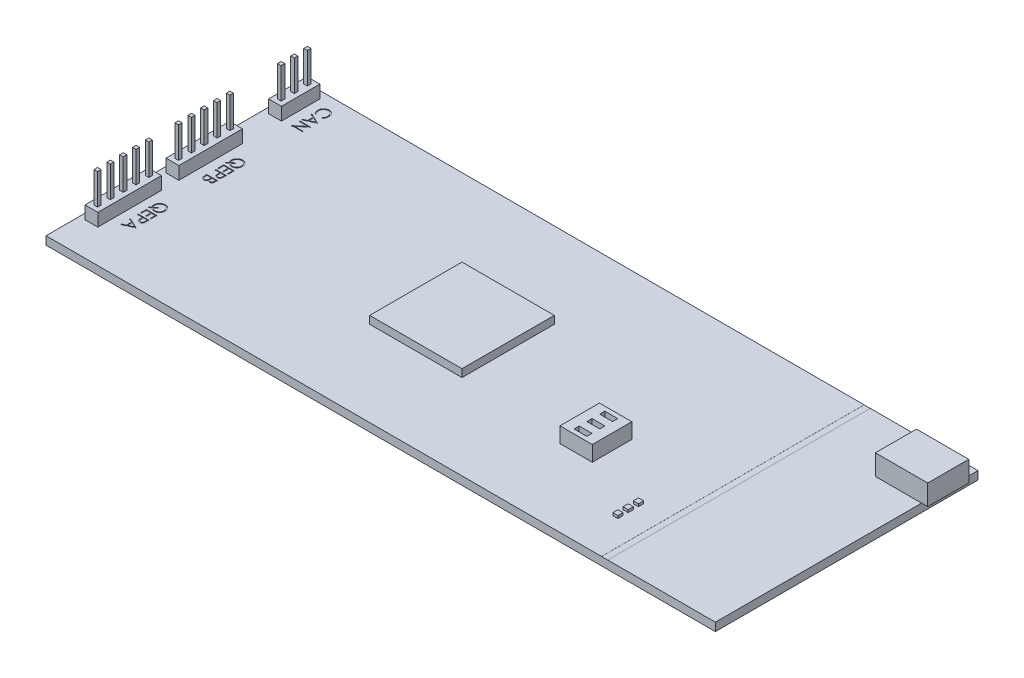
from build123d import *

# Parameters (mm, degrees)
SKIZZE1_W                            = 130.5
SKIZZE1_H                            = 51.2
AUFSATZ_LINEAR_AUSTRAGEN1_DEPTH      = 1.6
AUFSATZ_LINEAR_AUSTRAGEN2_DEPTH      = 1.2
AUFSATZ_LINEAR_AUSTRAGEN2_DEPTH_BACK = 9
SKIZZE2_W                            = 8
SKIZZE2_H                            = 4
SKIZZE4_W                            = 2.5
SKIZZE4_H                            = 7.5
SKIZZE4_H_2                          = 12.4
AUFSATZ_LINEAR_AUSTRAGEN3_DEPTH      = 2.5
SKIZZE5_W                            = 0.7
SKIZZE5_H                            = 0.7
AUFSATZ_LINEAR_AUSTRAGEN4_DEPTH      = 6
SKIZZE6_W                            = 1.2
SKIZZE6_H                            = 51.2
SCHNITT_LINEAR_AUSTRAGEN1_DEPTH      = 0.01
SKIZZE7_W                            = 18
SKIZZE7_H                            = 18
AUFSATZ_LINEAR_AUSTRAGEN5_DEPTH      = 1.5
SKIZZE8_W                            = 6.3
SKIZZE8_H                            = 7.7
AUFSATZ_LINEAR_AUSTRAGEN6_DEPTH      = 3
SKIZZE9_W                            = 2.5
SKIZZE9_H                            = 1
SCHNITT_LINEAR_AUSTRAGEN2_DEPTH      = 1
SKIZZE10_W                           = 1
SKIZZE10_H                           = 1
AUFSATZ_LINEAR_AUSTRAGEN7_DEPTH      = 0.5
SCHNITT_LINEAR_AUSTRAGEN3_DEPTH      = 0.1


with BuildPart() as part:
    # Skizze1 → Aufsatz-Linear austragen1 (new body)
    with BuildSketch(Plane(origin=(0, 0, 0), x_dir=(1, 0, 0), z_dir=(0, 1, 0))):
        Rectangle(SKIZZE1_W, SKIZZE1_H)
    extrude(amount=AUFSATZ_LINEAR_AUSTRAGEN1_DEPTH)

    # Skizze2 → Aufsatz-Linear austragen2 (add, two sides: drawn at the far end of the back side and taken through both)
    with BuildSketch(Plane(origin=(65.25, 0, 0), x_dir=(0, 0, -1), z_dir=(1, 0, 0)).offset(-AUFSATZ_LINEAR_AUSTRAGEN2_DEPTH_BACK)):
        with Locations((18.6, 3.6)):
            Rectangle(SKIZZE2_W, SKIZZE2_H)
    extrude(amount=AUFSATZ_LINEAR_AUSTRAGEN2_DEPTH + AUFSATZ_LINEAR_AUSTRAGEN2_DEPTH_BACK)

    # Skizze4 → Aufsatz-Linear austragen3 (add)
    with BuildSketch(Plane(origin=(0, 1.6, 0), x_dir=(1, 0, 0), z_dir=(0, 1, 0))):
        with Locations((-62.9, 20.45)):
            Rectangle(SKIZZE4_W, SKIZZE4_H)
        with Locations((-62.9, 2.9)):
            Rectangle(SKIZZE4_W, SKIZZE4_H_2)
        with Locations((-62.9, -12.9)):
            Rectangle(SKIZZE4_W, SKIZZE4_H_2)
    extrude(amount=AUFSATZ_LINEAR_AUSTRAGEN3_DEPTH)

    # Skizze5 → Aufsatz-Linear austragen4 (add)
    with BuildSketch(Plane(origin=(0, 4.1, 0), x_dir=(1, 0, 0), z_dir=(0, 1, 0))):
        with Locations((-62.9, 23)):
            Rectangle(SKIZZE5_W, SKIZZE5_H)
        with Locations((-62.9, 20.45)):
            Rectangle(SKIZZE5_W, SKIZZE5_H)
        with Locations((-62.9, 17.9)):
            Rectangle(SKIZZE5_W, SKIZZE5_H)
        with Locations((-62.9, 7.9)):
            Rectangle(SKIZZE5_W, SKIZZE5_H)
        with Locations((-62.9, 5.4)):
            Rectangle(SKIZZE5_W, SKIZZE5_H)
        with Locations((-62.9, 2.9)):
            Rectangle(SKIZZE5_W, SKIZZE5_H)
        with Locations((-62.9, 0.4)):
            Rectangle(SKIZZE5_W, SKIZZE5_H)
        with Locations((-62.9, -2.1)):
            Rectangle(SKIZZE5_W, SKIZZE5_H)
        with Locations((-62.9, -7.9)):
            Rectangle(SKIZZE5_W, SKIZZE5_H)
        with Locations((-62.9, -10.4)):
            Rectangle(SKIZZE5_W, SKIZZE5_H)
        with Locations((-62.9, -12.9)):
            Rectangle(SKIZZE5_W, SKIZZE5_H)
        with Locations((-62.9, -15.4)):
            Rectangle(SKIZZE5_W, SKIZZE5_H)
        with Locations((-62.9, -17.9)):
            Rectangle(SKIZZE5_W, SKIZZE5_H)
    extrude(amount=AUFSATZ_LINEAR_AUSTRAGEN4_DEPTH)

    # Skizze6 → Schnitt-Linear austragen1 (cut)
    with BuildSketch(Plane(origin=(0, 1.6, 0), x_dir=(1, 0, 0), z_dir=(0, 1, 0))):
        with Locations((43.65, 0)):
            Rectangle(SKIZZE6_W, SKIZZE6_H)
    extrude(amount=-SCHNITT_LINEAR_AUSTRAGEN1_DEPTH, mode=Mode.SUBTRACT)

    # Skizze7 → Aufsatz-Linear austragen5 (add)
    with BuildSketch(Plane(origin=(0, 1.6, 0), x_dir=(1, 0, 0), z_dir=(0, 1, 0))):
        with Locations((-9.75, 0)):
            Rectangle(SKIZZE7_W, SKIZZE7_H)
    extrude(amount=AUFSATZ_LINEAR_AUSTRAGEN5_DEPTH)

    # Skizze8 → Aufsatz-Linear austragen6 (add)
    with BuildSketch(Plane(origin=(0, 1.6, 0), x_dir=(1, 0, 0), z_dir=(0, 1, 0))):
        with Locations((23.1, -6.75)):
            Rectangle(SKIZZE8_W, SKIZZE8_H)
    extrude(amount=AUFSATZ_LINEAR_AUSTRAGEN6_DEPTH)

    # Skizze9 → Schnitt-Linear austragen2 (cut)
    with BuildSketch(Plane(origin=(0, 4.6, 0), x_dir=(1, 0, 0), z_dir=(0, 1, 0))):
        with Locations((23.1, -4.25)):
            Rectangle(SKIZZE9_W, SKIZZE9_H)
        with Locations((23.1, -6.75)):
            Rectangle(SKIZZE9_W, SKIZZE9_H)
        with Locations((23.1, -9.25)):
            Rectangle(SKIZZE9_W, SKIZZE9_H)
    extrude(amount=-SCHNITT_LINEAR_AUSTRAGEN2_DEPTH, mode=Mode.SUBTRACT)

    # Skizze10 → Aufsatz-Linear austragen7 (add)
    with BuildSketch(Plane(origin=(0, 1.6, 0), x_dir=(1, 0, 0), z_dir=(0, 1, 0))):
        with Locations((37.75, -13.1)):
            Rectangle(SKIZZE10_W, SKIZZE10_H)
        with Locations((37.75, -15.1)):
            Rectangle(SKIZZE10_W, SKIZZE10_H)
        with Locations((37.75, -17.1)):
            Rectangle(SKIZZE10_W, SKIZZE10_H)
    extrude(amount=AUFSATZ_LINEAR_AUSTRAGEN7_DEPTH)

    # Skizze11 → Schnitt-Linear austragen3 (cut)
    # profile 1 of 11: a face of its own
    with BuildSketch(Plane(origin=(0, 1.6, 0), x_dir=(1, 0, 0), z_dir=(0, 1, 0))):
        with BuildLine():
            Line((-59.654629934, 4.468969889), (-60.049308686, 4.146928822))
            Line((-60.049308686, 4.146928822), (-60.049308686, 4.381636718))
            Line((-60.049308686, 4.381636718), (-59.76463614, 4.614245259))
            add(Edge.make_bspline(
                [(-59.76463614, 4.614245259), (-59.778813299, 4.637574949), (-59.806906463, 4.683804577), (-59.843116991, 4.755886863), (-59.873248874, 4.829402609), (-59.898143303, 4.904189153), (-59.918069834, 4.980137564), (-59.931899689, 5.05763297), (-59.939930513, 5.136394302), (-59.941188906, 5.189310659), (-59.941821707, 5.21592042)],
                knots=[0, 0, 0, 0, 1.030216282, 2.041455142, 3.041201647, 4.026904037, 5.014869161, 6.002481075, 6.995518502, 8, 8, 8, 8], degree=3))
            add(Edge.make_bspline(
                [(-59.941821707, 5.21592042), (-59.940901756, 5.254043165), (-59.939091565, 5.329057377), (-59.923341685, 5.439238054), (-59.898860966, 5.54508193), (-59.863915556, 5.646317067), (-59.818555313, 5.742761657), (-59.763199092, 5.834711943), (-59.697952765, 5.922200169), (-59.623447565, 6.003887969), (-59.542387484, 6.078579763), (-59.455780755, 6.144118012), (-59.365061759, 6.199843008), (-59.269778826, 6.244900043), (-59.170761275, 6.280658808), (-59.067185657, 6.305027439), (-58.95966853, 6.32080097), (-58.886462471, 6.322618119), (-58.849317333, 6.323540151)],
                knots=[0, 0, 0, 0, 1.05574053, 2.077383083, 3.077194498, 4.061905691, 5.03852134, 6.024727803, 7.030589082, 8.057245348, 9.083652609, 10.080210343, 11.061793968, 12.027891381, 12.99559829, 13.972775731, 14.971375788, 16, 16, 16, 16], degree=3))
            add(Edge.make_bspline(
                [(-58.849317333, 6.323540151), (-58.824386188, 6.323212102), (-58.77469906, 6.322558309), (-58.701107336, 6.314995265), (-58.628727123, 6.303758456), (-58.557859204, 6.287864425), (-58.488213097, 6.267057817), (-58.419926153, 6.242112828), (-58.353174254, 6.211888704), (-58.288094308, 6.177720879), (-58.225249293, 6.139614644), (-58.165537613, 6.098102135), (-58.109533244, 6.053092765), (-58.057315163, 6.004575994), (-58.008495941, 5.952824279), (-57.963173869, 5.897849954), (-57.921317466, 5.839533123), (-57.883394498, 5.778176133), (-57.849456271, 5.714303743), (-57.819438964, 5.648979827), (-57.79476201, 5.581762067), (-57.774013037, 5.513266169), (-57.75807213, 5.443101113), (-57.746922716, 5.371405233), (-57.739285374, 5.298240311), (-57.738656141, 5.248830044), (-57.738338634, 5.223897969)],
                knots=[0, 0, 0, 0, 1.030754547, 2.054267169, 3.056358621, 4.059035041, 5.05535882, 6.060771698, 7.063448118, 8.083599711, 9.099159154, 10.101167011, 11.089250986, 12.068187652, 13.04685046, 14.029613114, 15.012716649, 16.013469748, 17.010449097, 18.0025771, 18.984265202, 19.969496577, 20.960881312, 21.957255534, 22.969245453, 24, 24, 24, 24], degree=3))
            add(Edge.make_bspline(
                [(-57.738338634, 5.223897969), (-57.739252448, 5.185774558), (-57.741047236, 5.110897738), (-57.756821339, 5.000997495), (-57.781289755, 4.895566594), (-57.816326656, 4.79464607), (-57.861635412, 4.698342893), (-57.916695665, 4.606445123), (-57.982513267, 4.519668454), (-58.056574427, 4.438040238), (-58.137874106, 4.363486689), (-58.225202164, 4.298748857), (-58.316654867, 4.243184447), (-58.412948495, 4.198075837), (-58.513842965, 4.163003639), (-58.619413765, 4.138494988), (-58.729463263, 4.122793202), (-58.80447693, 4.120979045), (-58.842599397, 4.120057078)],
                knots=[0, 0, 0, 0, 1.050621994, 2.063488829, 3.054696817, 4.03098776, 5.002868493, 5.984293541, 6.979100426, 8.000779165, 9.019604587, 10.015189519, 10.993309009, 11.965189742, 12.941480684, 13.932688673, 14.949378006, 16, 16, 16, 16], degree=3))
            add(Edge.make_bspline(
                [(-58.842599397, 4.120057078), (-58.882269411, 4.121051498), (-58.960278247, 4.123006971), (-59.074578654, 4.140053183), (-59.183984052, 4.166463061), (-59.287954481, 4.205115654), (-59.386977599, 4.254673563), (-59.481345227, 4.315247147), (-59.571905185, 4.386166599), (-59.626764618, 4.441078117), (-59.654629934, 4.468969889)],
                knots=[0, 0, 0, 0, 1.045518584, 2.0559531, 3.040547655, 4.008540931, 4.974054662, 5.954823866, 6.961172636, 8, 8, 8, 8], degree=3))
        make_face()
        with BuildLine():
            add(Edge.make_bspline(
                [(-59.499697531, 4.595351064), (-59.476472114, 4.572481542), (-59.430786688, 4.527496179), (-59.355865008, 4.469128555), (-59.277985439, 4.418926542), (-59.196111999, 4.378734366), (-59.111270441, 4.346756011), (-59.022788514, 4.324662479), (-58.93106903, 4.310828856), (-58.868680595, 4.309055689), (-58.837141073, 4.308159291)],
                knots=[0, 0, 0, 0, 1.052210109, 2.069743939, 3.061837814, 4.040478349, 5.010453814, 5.985306305, 6.981502329, 8, 8, 8, 8], degree=3))
            add(Edge.make_bspline(
                [(-58.837141073, 4.308159291), (-58.816830013, 4.308393506), (-58.776678627, 4.308856509), (-58.717261619, 4.315222782), (-58.659156912, 4.324229166), (-58.602468325, 4.337267648), (-58.547310711, 4.35405801), (-58.493758947, 4.374795581), (-58.44164027, 4.399076324), (-58.39127844, 4.427382365), (-58.34274645, 4.45858738), (-58.296637823, 4.493322389), (-58.253190309, 4.531098479), (-58.211687913, 4.571502962), (-58.172986152, 4.615314836), (-58.137101616, 4.662376976), (-58.103165908, 4.712109469), (-58.072534552, 4.764758413), (-58.0443738, 4.819013134), (-58.019988331, 4.874556167), (-57.999334713, 4.930921134), (-57.982587281, 4.988020751), (-57.969404919, 5.04578113), (-57.960408613, 5.104303538), (-57.954048896, 5.163436636), (-57.953558236, 5.203167421), (-57.953312592, 5.223058227)],
                knots=[0, 0, 0, 0, 1.032958288, 2.041976502, 3.037103433, 4.023477888, 4.998866292, 5.968231228, 6.943073582, 7.921783703, 8.90545537, 9.876780072, 10.85618943, 11.833110341, 12.821898168, 13.827467856, 14.842673888, 15.88323808, 16.924703457, 17.951432745, 18.967462636, 19.976958182, 20.977218729, 21.979378626, 22.98839684, 24, 24, 24, 24], degree=3))
            add(Edge.make_bspline(
                [(-57.953312592, 5.223058227), (-57.953559976, 5.243088609), (-57.954054107, 5.283097923), (-57.960373133, 5.342516674), (-57.96941595, 5.401172758), (-57.982527457, 5.458811984), (-57.999327464, 5.515624275), (-58.019985965, 5.571366278), (-58.043993255, 5.626448952), (-58.071980968, 5.680050976), (-58.103048736, 5.731996969), (-58.136367856, 5.781704744), (-58.173164337, 5.82789742), (-58.212227173, 5.871294579), (-58.254069638, 5.911784078), (-58.298376486, 5.949582093), (-58.345671704, 5.984018171), (-58.395106456, 6.015568451), (-58.446735167, 6.043453993), (-58.499626141, 6.068603238), (-58.554362544, 6.089030005), (-58.610506255, 6.10579995), (-58.6679177, 6.119503532), (-58.726930148, 6.128336023), (-58.787175209, 6.134750051), (-58.827886133, 6.135206876), (-58.848477591, 6.135437937)],
                knots=[0, 0, 0, 0, 1.013232303, 2.023861962, 3.020621903, 4.015492728, 5.012755829, 6.016661994, 7.022041205, 8.051604144, 9.07437186, 10.084107639, 11.077439333, 12.060337995, 13.03706716, 14.02195431, 15.005108131, 15.995405045, 16.987448092, 17.972869919, 18.956865295, 19.940554735, 20.937012659, 21.9407689, 22.958447392, 24, 24, 24, 24], degree=3))
            add(Edge.make_bspline(
                [(-58.848477591, 6.135437937), (-58.878749901, 6.134647252), (-58.9383049, 6.133091731), (-59.025769478, 6.12032083), (-59.109349865, 6.098610924), (-59.189778463, 6.069307749), (-59.266389871, 6.030767444), (-59.339592169, 5.983964702), (-59.408436412, 5.927927951), (-59.473608062, 5.865081881), (-59.532642067, 5.795928165), (-59.584600775, 5.72262429), (-59.628682541, 5.645789169), (-59.66426182, 5.565183345), (-59.692833145, 5.48140742), (-59.712176512, 5.393800197), (-59.724997813, 5.302934334), (-59.726225326, 5.241017766), (-59.726847749, 5.209622355)],
                knots=[0, 0, 0, 0, 1.022497099, 2.011568113, 2.978414599, 3.935907004, 4.898116866, 5.870095606, 6.865600239, 7.892254889, 8.925238965, 9.932855416, 10.924083129, 11.912667955, 12.905586126, 13.909344924, 14.939912558, 16, 16, 16, 16], degree=3))
            add(Edge.make_bspline(
                [(-59.726847749, 5.209622355), (-59.726613953, 5.188052233), (-59.726151523, 5.145388055), (-59.719798222, 5.08247993), (-59.710961924, 5.02122736), (-59.697186398, 4.962016629), (-59.680558993, 4.904281363), (-59.659941505, 4.848437951), (-59.635639108, 4.794341539), (-59.616398933, 4.75994797), (-59.606764639, 4.742725789)],
                knots=[0, 0, 0, 0, 1.060709028, 2.098007545, 3.107816471, 4.10334608, 5.086030226, 6.061961114, 7.029549518, 8, 8, 8, 8], degree=3))
            Line((-59.606764639, 4.742725789), (-59.028182384, 5.214660807))
            Line((-59.028182384, 5.214660807), (-59.028182384, 4.979952911))
            Line((-59.028182384, 4.979952911), (-59.499697531, 4.595351064))
        make_face(mode=Mode.SUBTRACT)
    # profile 2 of 11: a face of its own
    with BuildSketch(Plane(origin=(0, 1.6, 0), x_dir=(1, 0, 0), z_dir=(0, 1, 0))):
        Polygon((-57.792082124, 3.690109161), (-57.792082124, 2.50775239), (-58.007056082, 2.50775239), (-58.007056082, 3.502006947), (-58.651977957, 3.502006947), (-58.651977957, 2.50775239), (-58.866951915, 2.50775239), (-58.866951915, 3.502006947), (-59.673104259, 3.502006947), (-59.673104259, 2.50775239), (-59.888078217, 2.50775239), (-59.888078217, 3.690109161), align=None)
    # profile 3 of 11: a face of its own
    with BuildSketch(Plane(origin=(0, 1.6, 0), x_dir=(1, 0, 0), z_dir=(0, 1, 0))):
        with BuildLine():
            Line((-57.792082124, 2.131547963), (-57.792082124, 1.720494242))
            add(Edge.make_bspline(
                [(-57.792082124, 1.720494242), (-57.792113202, 1.692221706), (-57.79217275, 1.638050272), (-57.793978148, 1.560369629), (-57.796389557, 1.489818562), (-57.799732307, 1.426549194), (-57.803682715, 1.370366859), (-57.809223355, 1.321525778), (-57.815008481, 1.279642053), (-57.82089009, 1.254546124), (-57.82357245, 1.243100901)],
                knots=[0, 0, 0, 0, 1.415646017, 2.712440637, 3.8905458, 4.950247383, 5.884950622, 6.709939814, 7.411656543, 8, 8, 8, 8], degree=3))
            add(Edge.make_bspline(
                [(-57.82357245, 1.243100901), (-57.827538009, 1.228612423), (-57.835375684, 1.199976871), (-57.851074442, 1.158715561), (-57.869686284, 1.119456408), (-57.890907148, 1.082075684), (-57.915605286, 1.046992298), (-57.942999425, 1.01375716), (-57.973074493, 0.982179641), (-58.006413518, 0.953332422), (-58.041787299, 0.926774852), (-58.07998363, 0.903992487), (-58.120171183, 0.884721613), (-58.162761526, 0.868983179), (-58.207495808, 0.857015897), (-58.254504622, 0.848174092), (-58.30362644, 0.842516995), (-58.337198945, 0.841978394), (-58.354289409, 0.841704213)],
                knots=[0, 0, 0, 0, 0.999487232, 1.975422798, 2.933948774, 3.889618007, 4.832992075, 5.786114792, 6.754729845, 7.731954186, 8.717668599, 9.695514499, 10.68728626, 11.680675814, 12.71351902, 13.766008651, 14.862761406, 16, 16, 16, 16], degree=3))
            add(Edge.make_bspline(
                [(-58.354289409, 0.841704213), (-58.371523154, 0.841956586), (-58.40524214, 0.84245037), (-58.454571581, 0.84837682), (-58.501712563, 0.856359686), (-58.546560562, 0.868634469), (-58.588849242, 0.884711162), (-58.629224853, 0.903570368), (-58.667000495, 0.926317034), (-58.702313308, 0.952454003), (-58.73519644, 0.981529418), (-58.765411598, 1.013420261), (-58.792781917, 1.047997784), (-58.817368756, 1.085152099), (-58.838601962, 1.125245419), (-58.857620016, 1.16766967), (-58.873592141, 1.212793601), (-58.881994128, 1.24401946), (-58.886265982, 1.259895741)],
                knots=[0, 0, 0, 0, 1.121902311, 2.195077645, 3.232258892, 4.234102512, 5.217864754, 6.176164875, 7.132989551, 8.084763148, 9.034132444, 9.988522005, 10.94243251, 11.903244335, 12.886203696, 13.894208494, 14.929344452, 16, 16, 16, 16], degree=3))
            add(Edge.make_bspline(
                [(-58.886265982, 1.259895741), (-58.889058436, 1.273027057), (-58.895178262, 1.3018051), (-58.902010285, 1.349200196), (-58.907841706, 1.404382016), (-58.912214036, 1.467275241), (-58.915957107, 1.537823419), (-58.91893228, 1.616064712), (-58.92056707, 1.702152707), (-58.920651384, 1.762200746), (-58.920695405, 1.793551798)],
                knots=[0, 0, 0, 0, 0.601384939, 1.31797006, 2.144135048, 3.087295005, 4.142315834, 5.309527816, 6.595305764, 8, 8, 8, 8], degree=3))
            Line((-58.920695405, 1.793551798), (-58.920695405, 1.94344575))
            Line((-58.920695405, 1.94344575), (-59.888078217, 1.94344575))
            Line((-59.888078217, 1.94344575), (-59.888078217, 2.131547963))
            Line((-59.888078217, 2.131547963), (-57.792082124, 2.131547963))
        make_face()
        with BuildLine():
            Line((-58.007056082, 1.94344575), (-58.705721447, 1.94344575))
            Line((-58.705721447, 1.94344575), (-58.710340028, 1.576478485))
            add(Edge.make_bspline(
                [(-58.710340028, 1.576478485), (-58.710351233, 1.558560582), (-58.710372863, 1.523970439), (-58.707953542, 1.473866952), (-58.705284868, 1.427501723), (-58.70110561, 1.384774063), (-58.695599045, 1.346010499), (-58.689605255, 1.310713127), (-58.681484861, 1.279398682), (-58.670162264, 1.242703886), (-58.651227721, 1.201953472), (-58.623035568, 1.157915677), (-58.588086293, 1.11999016), (-58.548251238, 1.08739033), (-58.503775248, 1.062125549), (-58.45656191, 1.043123212), (-58.406581514, 1.03205446), (-58.372396539, 1.030560865), (-58.355129151, 1.029806427)],
                knots=[0, 0, 0, 0, 1.160368111, 2.240066715, 3.248291599, 4.168343349, 5.019594299, 5.784185847, 6.485545725, 7.113397927, 8.269509094, 9.383373363, 10.487084095, 11.595623793, 12.704274681, 13.786671823, 14.88201193, 16, 16, 16, 16], degree=3))
            add(Edge.make_bspline(
                [(-58.355129151, 1.029806427), (-58.338279542, 1.030564894), (-58.304784605, 1.032072634), (-58.255671811, 1.043210521), (-58.208959388, 1.062088454), (-58.165030953, 1.087561528), (-58.125358924, 1.119225313), (-58.091198399, 1.156310365), (-58.063363571, 1.198059433), (-58.04552174, 1.23691512), (-58.034609899, 1.271406875), (-58.026978426, 1.301369558), (-58.020884433, 1.335199104), (-58.01595024, 1.372907811), (-58.011726207, 1.414203004), (-58.008860104, 1.459439586), (-58.007182432, 1.508446154), (-58.007099218, 1.542467507), (-58.007056082, 1.560103515)],
                knots=[0, 0, 0, 0, 1.120550889, 2.227516482, 3.330715807, 4.461473166, 5.594337325, 6.694900473, 7.802844763, 8.919519911, 9.52614448, 10.208195984, 10.975273469, 11.811520316, 12.738076669, 13.736566072, 14.826679847, 16, 16, 16, 16], degree=3))
            Line((-58.007056082, 1.560103515), (-58.007056082, 1.94344575))
        make_face(mode=Mode.SUBTRACT)
    # profile 4 of 11: a face of its own
    with BuildSketch(Plane(origin=(0, 1.6, 0), x_dir=(1, 0, 0), z_dir=(0, 1, 0))):
        with BuildLine():
            Line((-57.792082124, 0.411756296), (-57.792082124, 0.00280193))
            add(Edge.make_bspline(
                [(-57.792082124, 0.00280193), (-57.792187373, -0.017216915), (-57.792391372, -0.05601842), (-57.795555207, -0.112442301), (-57.799869168, -0.165290633), (-57.806714148, -0.214578743), (-57.814973437, -0.260283856), (-57.82497542, -0.302543711), (-57.836968478, -0.341223925), (-57.856039816, -0.387403351), (-57.88437958, -0.440055169), (-57.926256723, -0.4970653), (-57.977478354, -0.54581472), (-58.035257574, -0.587846219), (-58.09881762, -0.621263056), (-58.166643568, -0.645438453), (-58.23786057, -0.66074394), (-58.286753079, -0.662317994), (-58.311462566, -0.663113495)],
                knots=[0, 0, 0, 0, 1.001505555, 1.941167018, 2.826882275, 3.653841531, 4.429895133, 5.150066043, 5.825578002, 6.45369114, 7.647487171, 8.808567382, 9.977351308, 11.170798116, 12.373658725, 13.556498008, 14.765093433, 16, 16, 16, 16], degree=3))
            add(Edge.make_bspline(
                [(-58.311462566, -0.663113495), (-58.334613804, -0.662471468), (-58.38010817, -0.661209823), (-58.446541526, -0.648734663), (-58.510040956, -0.630160928), (-58.569823643, -0.603197354), (-58.625121251, -0.568513853), (-58.675605147, -0.526776263), (-58.720051898, -0.477082205), (-58.744796463, -0.439790445), (-58.757365581, -0.420847921)],
                knots=[0, 0, 0, 0, 1.044266239, 2.052081639, 3.041743201, 4.026043445, 5.00270663, 5.980942822, 6.97441044, 8, 8, 8, 8], degree=3))
            add(Edge.make_bspline(
                [(-58.757365581, -0.420847921), (-58.766500063, -0.444662681), (-58.78397659, -0.490226215), (-58.815043007, -0.552972741), (-58.848451549, -0.607249879), (-58.885128453, -0.653117372), (-58.925156633, -0.691753636), (-58.967734547, -0.726449803), (-59.014958365, -0.755517412), (-59.065483423, -0.780488939), (-59.118955109, -0.800141268), (-59.175128879, -0.814046581), (-59.233376606, -0.822590719), (-59.273078351, -0.823755797), (-59.293120993, -0.824343964)],
                knots=[0, 0, 0, 0, 1.272302504, 2.434229863, 3.488457646, 4.447234501, 5.35599188, 6.26022912, 7.18267843, 8.11661068, 9.06895546, 10.019249207, 11.000057067, 12, 12, 12, 12], degree=3))
            add(Edge.make_bspline(
                [(-59.293120993, -0.824343964), (-59.313581914, -0.82375879), (-59.35383935, -0.822607445), (-59.412981115, -0.814118305), (-59.46949203, -0.79973067), (-59.523773897, -0.779961272), (-59.575519461, -0.75401312), (-59.625376792, -0.723115633), (-59.672017724, -0.685509475), (-59.71655143, -0.643592089), (-59.75656901, -0.59611614), (-59.792195767, -0.544900739), (-59.821629534, -0.489209239), (-59.846045563, -0.42990527), (-59.864967861, -0.366594754), (-59.878104598, -0.299512431), (-59.886976757, -0.228643723), (-59.887704834, -0.180010424), (-59.888078217, -0.15506957)],
                knots=[0, 0, 0, 0, 0.978404568, 1.925038397, 2.85041836, 3.763147166, 4.682162379, 5.614488577, 6.562659439, 7.54271123, 8.535210642, 9.526693784, 10.520907202, 11.541451354, 12.589717429, 13.675358278, 14.807842563, 16, 16, 16, 16], degree=3))
            Line((-59.888078217, -0.15506957), (-59.888078217, 0.411756296))
            Line((-59.888078217, 0.411756296), (-57.792082124, 0.411756296))
        make_face()
        with BuildLine():
            Line((-58.007056082, 0.223654083), (-58.678849702, 0.223654083))
            Line((-58.678849702, 0.223654083), (-58.678849702, 0.097272908))
            add(Edge.make_bspline(
                [(-58.678849702, 0.097272908), (-58.678612198, 0.078798755), (-58.678153294, 0.043102926), (-58.676797317, -0.008727639), (-58.67316679, -0.056718355), (-58.669326908, -0.101034591), (-58.663414276, -0.141379318), (-58.656178876, -0.177887602), (-58.648593675, -0.210887399), (-58.635657664, -0.248926116), (-58.616733436, -0.292061517), (-58.58667399, -0.337753222), (-58.551843573, -0.378688184), (-58.510912623, -0.412868361), (-58.466225094, -0.441072982), (-58.417777001, -0.459895522), (-58.367459742, -0.473246102), (-58.33282582, -0.474416861), (-58.315241405, -0.475011282)],
                knots=[0, 0, 0, 0, 1.156481963, 2.23455883, 3.244418989, 4.168404366, 5.01828131, 5.794834307, 6.498111525, 7.13526334, 8.307595709, 9.435046769, 10.546766856, 11.659452936, 12.760769924, 13.837671619, 14.902137667, 16, 16, 16, 16], degree=3))
            add(Edge.make_bspline(
                [(-58.315241405, -0.475011282), (-58.303602686, -0.474713987), (-58.280772067, -0.474130811), (-58.247618479, -0.468823216), (-58.216038518, -0.461121843), (-58.186758499, -0.44908995), (-58.158946202, -0.434540904), (-58.133836957, -0.415615236), (-58.110055129, -0.39424174), (-58.088473928, -0.369140648), (-58.069137087, -0.340433503), (-58.052122364, -0.307846778), (-58.038700664, -0.270991371), (-58.026660684, -0.230702936), (-58.01830625, -0.186336692), (-58.011320831, -0.138326159), (-58.007769949, -0.086264049), (-58.007299345, -0.050245897), (-58.007056082, -0.031627493)],
                knots=[0, 0, 0, 0, 0.911752476, 1.788502045, 2.626783689, 3.45400582, 4.26402138, 5.080402872, 5.911472738, 6.767166405, 7.66795952, 8.620018292, 9.640966946, 10.73819047, 11.913090943, 13.176185384, 14.540321519, 16, 16, 16, 16], degree=3))
            Line((-58.007056082, -0.031627493), (-58.007056082, 0.223654083))
        make_face(mode=Mode.SUBTRACT)
        with BuildLine():
            Line((-58.89382366, 0.223654083), (-59.673104259, 0.223654083))
            Line((-59.673104259, 0.223654083), (-59.673104259, -0.044223623))
            add(Edge.make_bspline(
                [(-59.673104259, -0.044223623), (-59.672875252, -0.063398445), (-59.672433872, -0.100355386), (-59.670977218, -0.153712929), (-59.667733467, -0.203033734), (-59.662445287, -0.248346182), (-59.656950407, -0.290049145), (-59.649345228, -0.327728304), (-59.640699059, -0.361441424), (-59.627318703, -0.400527673), (-59.606567565, -0.444569561), (-59.57507549, -0.49199824), (-59.538051564, -0.534587247), (-59.494660886, -0.570338585), (-59.447838141, -0.599860638), (-59.397828229, -0.620566177), (-59.346156801, -0.633879541), (-59.310835184, -0.635452762), (-59.293120993, -0.63624175)],
                knots=[0, 0, 0, 0, 1.159821618, 2.235403267, 3.228114831, 4.14795534, 4.994323282, 5.771256229, 6.471395042, 7.097801288, 8.267864287, 9.404187171, 10.531774336, 11.667624178, 12.792825787, 13.866573821, 14.930062559, 16, 16, 16, 16], degree=3))
            add(Edge.make_bspline(
                [(-59.293120993, -0.63624175), (-59.282044712, -0.636080484), (-59.260070811, -0.635760551), (-59.227803886, -0.63075415), (-59.196408506, -0.623769894), (-59.166359412, -0.613656091), (-59.137167643, -0.600903405), (-59.109341674, -0.584899267), (-59.082216175, -0.56641752), (-59.047962816, -0.537505961), (-59.008483696, -0.495493282), (-58.969836469, -0.435779856), (-58.938666918, -0.367887139), (-58.925432571, -0.318644571), (-58.91859605, -0.293207133)],
                knots=[0, 0, 0, 0, 0.723503378, 1.435336582, 2.130201219, 2.824764462, 3.504949994, 4.209866579, 4.920640069, 5.648298893, 7.13757748, 8.670694625, 10.280166878, 12, 12, 12, 12], degree=3))
            add(Edge.make_bspline(
                [(-58.91859605, -0.293207133), (-58.916526813, -0.283009166), (-58.91204028, -0.26089787), (-58.907307379, -0.224842014), (-58.903061812, -0.183541098), (-58.900003818, -0.137171648), (-58.896721115, -0.085549248), (-58.895489901, -0.028690482), (-58.89398714, 0.033444848), (-58.893879547, 0.076557967), (-58.89382366, 0.098952392)],
                knots=[0, 0, 0, 0, 0.634452549, 1.375623993, 2.216454381, 3.166361212, 4.209414599, 5.370755378, 6.634280627, 8, 8, 8, 8], degree=3))
            Line((-58.89382366, 0.098952392), (-58.89382366, 0.223654083))
        make_face(mode=Mode.SUBTRACT)
    # profile 5 of 11: a face of its own
    with BuildSketch(Plane(origin=(0, 1.6, 0), x_dir=(1, 0, 0), z_dir=(0, 1, 0))):
        with BuildLine():
            Line((-59.654629934, -10.608142342), (-60.049308686, -10.930183408))
            Line((-60.049308686, -10.930183408), (-60.049308686, -10.695475512))
            Line((-60.049308686, -10.695475512), (-59.76463614, -10.462866971))
            add(Edge.make_bspline(
                [(-59.76463614, -10.462866971), (-59.778813299, -10.439537282), (-59.806906463, -10.393307654), (-59.843116991, -10.321225367), (-59.873248874, -10.247709622), (-59.898143303, -10.172923078), (-59.918069834, -10.096974666), (-59.931899689, -10.01947926), (-59.939930513, -9.940717929), (-59.941188906, -9.887801572), (-59.941821707, -9.861191811)],
                knots=[0, 0, 0, 0, 1.030216282, 2.041455142, 3.041201647, 4.026904037, 5.014869161, 6.002481075, 6.995518502, 8, 8, 8, 8], degree=3))
            add(Edge.make_bspline(
                [(-59.941821707, -9.861191811), (-59.940901756, -9.823069066), (-59.939091565, -9.748054853), (-59.923341685, -9.637874177), (-59.898860966, -9.532030301), (-59.863915556, -9.430795164), (-59.818555313, -9.334350573), (-59.763199092, -9.242400287), (-59.697952765, -9.154912061), (-59.623447565, -9.073224261), (-59.542387484, -8.998532467), (-59.455780755, -8.932994218), (-59.365061759, -8.877269222), (-59.269778826, -8.832212187), (-59.170761275, -8.796453423), (-59.067185657, -8.772084791), (-58.95966853, -8.756311261), (-58.886462471, -8.754494111), (-58.849317333, -8.75357208)],
                knots=[0, 0, 0, 0, 1.05574053, 2.077383083, 3.077194498, 4.061905691, 5.03852134, 6.024727803, 7.030589082, 8.057245348, 9.083652609, 10.080210343, 11.061793968, 12.027891381, 12.99559829, 13.972775731, 14.971375788, 16, 16, 16, 16], degree=3))
            add(Edge.make_bspline(
                [(-58.849317333, -8.75357208), (-58.824386188, -8.753900129), (-58.77469906, -8.754553922), (-58.701107336, -8.762116965), (-58.628727123, -8.773353774), (-58.557859204, -8.789247805), (-58.488213097, -8.810054414), (-58.419926153, -8.834999402), (-58.353174254, -8.865223526), (-58.288094308, -8.899391351), (-58.225249293, -8.937497586), (-58.165537613, -8.979010095), (-58.109533244, -9.024019465), (-58.057315163, -9.072536237), (-58.008495941, -9.124287952), (-57.963173869, -9.179262277), (-57.921317466, -9.237579108), (-57.883394498, -9.298936098), (-57.849456271, -9.362808487), (-57.819438964, -9.428132404), (-57.79476201, -9.495350164), (-57.774013037, -9.563846062), (-57.75807213, -9.634011117), (-57.746922716, -9.705706998), (-57.739285374, -9.77887192), (-57.738656141, -9.828282187), (-57.738338634, -9.853214261)],
                knots=[0, 0, 0, 0, 1.030754547, 2.054267169, 3.056358621, 4.059035041, 5.05535882, 6.060771698, 7.063448118, 8.083599711, 9.099159154, 10.101167011, 11.089250986, 12.068187652, 13.04685046, 14.029613114, 15.012716649, 16.013469748, 17.010449097, 18.0025771, 18.984265202, 19.969496577, 20.960881312, 21.957255534, 22.969245453, 24, 24, 24, 24], degree=3))
            add(Edge.make_bspline(
                [(-57.738338634, -9.853214261), (-57.739252448, -9.891337673), (-57.741047236, -9.966214493), (-57.756821339, -10.076114735), (-57.781289755, -10.181545636), (-57.816326656, -10.28246616), (-57.861635412, -10.378769338), (-57.916695665, -10.470667108), (-57.982513267, -10.557443777), (-58.056574427, -10.639071993), (-58.137874106, -10.713625542), (-58.225202164, -10.778363374), (-58.316654867, -10.833927784), (-58.412948495, -10.879036394), (-58.513842965, -10.914108591), (-58.619413765, -10.938617242), (-58.729463263, -10.954319028), (-58.80447693, -10.956133186), (-58.842599397, -10.957055153)],
                knots=[0, 0, 0, 0, 1.050621994, 2.063488829, 3.054696817, 4.03098776, 5.002868493, 5.984293541, 6.979100426, 8.000779165, 9.019604587, 10.015189519, 10.993309009, 11.965189742, 12.941480684, 13.932688673, 14.949378006, 16, 16, 16, 16], degree=3))
            add(Edge.make_bspline(
                [(-58.842599397, -10.957055153), (-58.882269411, -10.956060732), (-58.960278247, -10.95410526), (-59.074578654, -10.937059048), (-59.183984052, -10.91064917), (-59.287954481, -10.871996577), (-59.386977599, -10.822438667), (-59.481345227, -10.761865084), (-59.571905185, -10.690945631), (-59.626764618, -10.636034114), (-59.654629934, -10.608142342)],
                knots=[0, 0, 0, 0, 1.045518584, 2.0559531, 3.040547655, 4.008540931, 4.974054662, 5.954823866, 6.961172636, 8, 8, 8, 8], degree=3))
        make_face()
        with BuildLine():
            add(Edge.make_bspline(
                [(-59.499697531, -10.481761167), (-59.476472114, -10.504630689), (-59.430786688, -10.549616052), (-59.355865008, -10.607983676), (-59.277985439, -10.658185688), (-59.196111999, -10.698377864), (-59.111270441, -10.73035622), (-59.022788514, -10.752449752), (-58.93106903, -10.766283374), (-58.868680595, -10.768056542), (-58.837141073, -10.768952939)],
                knots=[0, 0, 0, 0, 1.052210109, 2.069743939, 3.061837814, 4.040478349, 5.010453814, 5.985306305, 6.981502329, 8, 8, 8, 8], degree=3))
            add(Edge.make_bspline(
                [(-58.837141073, -10.768952939), (-58.816830013, -10.768718724), (-58.776678627, -10.768255722), (-58.717261619, -10.761889448), (-58.659156912, -10.752883065), (-58.602468325, -10.739844583), (-58.547310711, -10.723054221), (-58.493758947, -10.702316649), (-58.44164027, -10.678035906), (-58.39127844, -10.649729866), (-58.34274645, -10.618524851), (-58.296637823, -10.583789841), (-58.253190309, -10.546013752), (-58.211687913, -10.505609269), (-58.172986152, -10.461797394), (-58.137101616, -10.414735254), (-58.103165908, -10.365002761), (-58.072534552, -10.312353817), (-58.0443738, -10.258099096), (-58.019988331, -10.202556064), (-57.999334713, -10.146191097), (-57.982587281, -10.08909148), (-57.969404919, -10.0313311), (-57.960408613, -9.972808692), (-57.954048896, -9.913675595), (-57.953558236, -9.87394481), (-57.953312592, -9.854054003)],
                knots=[0, 0, 0, 0, 1.032958288, 2.041976502, 3.037103433, 4.023477888, 4.998866292, 5.968231228, 6.943073582, 7.921783703, 8.90545537, 9.876780072, 10.85618943, 11.833110341, 12.821898168, 13.827467856, 14.842673888, 15.88323808, 16.924703457, 17.951432745, 18.967462636, 19.976958182, 20.977218729, 21.979378626, 22.98839684, 24, 24, 24, 24], degree=3))
            add(Edge.make_bspline(
                [(-57.953312592, -9.854054003), (-57.953559976, -9.834023621), (-57.954054107, -9.794014308), (-57.960373133, -9.734595556), (-57.96941595, -9.675939473), (-57.982527457, -9.618300246), (-57.999327464, -9.561487956), (-58.019985965, -9.505745952), (-58.043993255, -9.450663279), (-58.071980968, -9.397061255), (-58.103048736, -9.345115261), (-58.136367856, -9.295407486), (-58.173164337, -9.249214811), (-58.212227173, -9.205817651), (-58.254069638, -9.165328153), (-58.298376486, -9.127530137), (-58.345671704, -9.09309406), (-58.395106456, -9.061543779), (-58.446735167, -9.033658238), (-58.499626141, -9.008508993), (-58.554362544, -8.988082225), (-58.610506255, -8.971312281), (-58.6679177, -8.957608698), (-58.726930148, -8.948776207), (-58.787175209, -8.94236218), (-58.827886133, -8.941905354), (-58.848477591, -8.941674294)],
                knots=[0, 0, 0, 0, 1.013232303, 2.023861962, 3.020621903, 4.015492728, 5.012755829, 6.016661994, 7.022041205, 8.051604144, 9.07437186, 10.084107639, 11.077439333, 12.060337995, 13.03706716, 14.02195431, 15.005108131, 15.995405045, 16.987448092, 17.972869919, 18.956865295, 19.940554735, 20.937012659, 21.9407689, 22.958447392, 24, 24, 24, 24], degree=3))
            add(Edge.make_bspline(
                [(-58.848477591, -8.941674294), (-58.878749901, -8.942464978), (-58.9383049, -8.9440205), (-59.025769478, -8.9567914), (-59.109349865, -8.978501307), (-59.189778463, -9.007804481), (-59.266389871, -9.046344786), (-59.339592169, -9.093147528), (-59.408436412, -9.14918428), (-59.473608062, -9.21203035), (-59.532642067, -9.281184066), (-59.584600775, -9.354487941), (-59.628682541, -9.431323062), (-59.66426182, -9.511928886), (-59.692833145, -9.595704811), (-59.712176512, -9.683312033), (-59.724997813, -9.774177896), (-59.726225326, -9.836094464), (-59.726847749, -9.867489876)],
                knots=[0, 0, 0, 0, 1.022497099, 2.011568113, 2.978414599, 3.935907004, 4.898116866, 5.870095606, 6.865600239, 7.892254889, 8.925238965, 9.932855416, 10.924083129, 11.912667955, 12.905586126, 13.909344924, 14.939912558, 16, 16, 16, 16], degree=3))
            add(Edge.make_bspline(
                [(-59.726847749, -9.867489876), (-59.726613953, -9.889059998), (-59.726151523, -9.931724175), (-59.719798222, -9.9946323), (-59.710961924, -10.05588487), (-59.697186398, -10.115095602), (-59.680558993, -10.172830867), (-59.659941505, -10.22867428), (-59.635639108, -10.282770691), (-59.616398933, -10.317164261), (-59.606764639, -10.334386442)],
                knots=[0, 0, 0, 0, 1.060709028, 2.098007545, 3.107816471, 4.10334608, 5.086030226, 6.061961114, 7.029549518, 8, 8, 8, 8], degree=3))
            Line((-59.606764639, -10.334386442), (-59.028182384, -9.862451424))
            Line((-59.028182384, -9.862451424), (-59.028182384, -10.09715932))
            Line((-59.028182384, -10.09715932), (-59.499697531, -10.481761167))
        make_face(mode=Mode.SUBTRACT)
    # profile 6 of 11: a face of its own
    with BuildSketch(Plane(origin=(0, 1.6, 0), x_dir=(1, 0, 0), z_dir=(0, 1, 0))):
        Polygon((-57.792082124, -11.38700307), (-57.792082124, -12.56935984), (-58.007056082, -12.56935984), (-58.007056082, -11.575105283), (-58.651977957, -11.575105283), (-58.651977957, -12.56935984), (-58.866951915, -12.56935984), (-58.866951915, -11.575105283), (-59.673104259, -11.575105283), (-59.673104259, -12.56935984), (-59.888078217, -12.56935984), (-59.888078217, -11.38700307), align=None)
    # profile 7 of 11: a face of its own
    with BuildSketch(Plane(origin=(0, 1.6, 0), x_dir=(1, 0, 0), z_dir=(0, 1, 0))):
        with BuildLine():
            Line((-57.792082124, -12.945564267), (-57.792082124, -13.356617989))
            add(Edge.make_bspline(
                [(-57.792082124, -13.356617989), (-57.792113202, -13.384890524), (-57.79217275, -13.439061958), (-57.793978148, -13.516742601), (-57.796389557, -13.587293669), (-57.799732307, -13.650563036), (-57.803682715, -13.706745372), (-57.809223355, -13.755586452), (-57.815008481, -13.797470177), (-57.82089009, -13.822566107), (-57.82357245, -13.83401133)],
                knots=[0, 0, 0, 0, 1.415646017, 2.712440637, 3.8905458, 4.950247383, 5.884950622, 6.709939814, 7.411656543, 8, 8, 8, 8], degree=3))
            add(Edge.make_bspline(
                [(-57.82357245, -13.83401133), (-57.827538009, -13.848499807), (-57.835375684, -13.87713536), (-57.851074442, -13.91839667), (-57.869686284, -13.957655822), (-57.890907148, -13.995036546), (-57.915605286, -14.030119932), (-57.942999425, -14.063355071), (-57.973074493, -14.094932589), (-58.006413518, -14.123779809), (-58.041787299, -14.150337378), (-58.07998363, -14.173119744), (-58.120171183, -14.192390618), (-58.162761526, -14.208129052), (-58.207495808, -14.220096333), (-58.254504622, -14.228938138), (-58.30362644, -14.234595235), (-58.337198945, -14.235133836), (-58.354289409, -14.235408017)],
                knots=[0, 0, 0, 0, 0.999487232, 1.975422798, 2.933948774, 3.889618007, 4.832992075, 5.786114792, 6.754729845, 7.731954186, 8.717668599, 9.695514499, 10.68728626, 11.680675814, 12.71351902, 13.766008651, 14.862761406, 16, 16, 16, 16], degree=3))
            add(Edge.make_bspline(
                [(-58.354289409, -14.235408017), (-58.371523154, -14.235155645), (-58.40524214, -14.23466186), (-58.454571581, -14.22873541), (-58.501712563, -14.220752545), (-58.546560562, -14.208477761), (-58.588849242, -14.192401068), (-58.629224853, -14.173541863), (-58.667000495, -14.150795197), (-58.702313308, -14.124658227), (-58.73519644, -14.095582812), (-58.765411598, -14.063691969), (-58.792781917, -14.029114446), (-58.817368756, -13.991960132), (-58.838601962, -13.951866811), (-58.857620016, -13.909442561), (-58.873592141, -13.86431863), (-58.881994128, -13.833092771), (-58.886265982, -13.817216489)],
                knots=[0, 0, 0, 0, 1.121902311, 2.195077645, 3.232258892, 4.234102512, 5.217864754, 6.176164875, 7.132989551, 8.084763148, 9.034132444, 9.988522005, 10.94243251, 11.903244335, 12.886203696, 13.894208494, 14.929344452, 16, 16, 16, 16], degree=3))
            add(Edge.make_bspline(
                [(-58.886265982, -13.817216489), (-58.889058436, -13.804085173), (-58.895178262, -13.77530713), (-58.902010285, -13.727912034), (-58.907841706, -13.672730214), (-58.912214036, -13.609836989), (-58.915957107, -13.539288812), (-58.91893228, -13.461047519), (-58.92056707, -13.374959524), (-58.920651384, -13.314911485), (-58.920695405, -13.283560432)],
                knots=[0, 0, 0, 0, 0.601384939, 1.31797006, 2.144135048, 3.087295005, 4.142315834, 5.309527816, 6.595305764, 8, 8, 8, 8], degree=3))
            Line((-58.920695405, -13.283560432), (-58.920695405, -13.133666481))
            Line((-58.920695405, -13.133666481), (-59.888078217, -13.133666481))
            Line((-59.888078217, -13.133666481), (-59.888078217, -12.945564267))
            Line((-59.888078217, -12.945564267), (-57.792082124, -12.945564267))
        make_face()
        with BuildLine():
            Line((-58.007056082, -13.133666481), (-58.705721447, -13.133666481))
            Line((-58.705721447, -13.133666481), (-58.710340028, -13.500633746))
            add(Edge.make_bspline(
                [(-58.710340028, -13.500633746), (-58.710351233, -13.518551649), (-58.710372863, -13.553141792), (-58.707953542, -13.603245278), (-58.705284868, -13.649610508), (-58.70110561, -13.692338167), (-58.695599045, -13.731101731), (-58.689605255, -13.766399103), (-58.681484861, -13.797713549), (-58.670162264, -13.834408345), (-58.651227721, -13.875158759), (-58.623035568, -13.919196553), (-58.588086293, -13.957122071), (-58.548251238, -13.9897219), (-58.503775248, -14.014986682), (-58.45656191, -14.033989019), (-58.406581514, -14.045057771), (-58.372396539, -14.046551365), (-58.355129151, -14.047305804)],
                knots=[0, 0, 0, 0, 1.160368111, 2.240066715, 3.248291599, 4.168343349, 5.019594299, 5.784185847, 6.485545725, 7.113397927, 8.269509094, 9.383373363, 10.487084095, 11.595623793, 12.704274681, 13.786671823, 14.88201193, 16, 16, 16, 16], degree=3))
            add(Edge.make_bspline(
                [(-58.355129151, -14.047305804), (-58.338279542, -14.046547336), (-58.304784605, -14.045039597), (-58.255671811, -14.033901709), (-58.208959388, -14.015023776), (-58.165030953, -13.989550702), (-58.125358924, -13.957886918), (-58.091198399, -13.920801865), (-58.063363571, -13.879052797), (-58.04552174, -13.84019711), (-58.034609899, -13.805705356), (-58.026978426, -13.775742673), (-58.020884433, -13.741913127), (-58.01595024, -13.70420442), (-58.011726207, -13.662909227), (-58.008860104, -13.617672645), (-58.007182432, -13.568666076), (-58.007099218, -13.534644723), (-58.007056082, -13.517008715)],
                knots=[0, 0, 0, 0, 1.120550889, 2.227516482, 3.330715807, 4.461473166, 5.594337325, 6.694900473, 7.802844763, 8.919519911, 9.52614448, 10.208195984, 10.975273469, 11.811520316, 12.738076669, 13.736566072, 14.826679847, 16, 16, 16, 16], degree=3))
            Line((-58.007056082, -13.517008715), (-58.007056082, -13.133666481))
        make_face(mode=Mode.SUBTRACT)
    # profile 8 of 11: a face of its own
    with BuildSketch(Plane(origin=(0, 1.6, 0), x_dir=(1, 0, 0), z_dir=(0, 1, 0))):
        Polygon((-57.792082124, -15.525251767), (-59.888078217, -16.49263458), (-59.888078217, -16.288157397), (-59.216284598, -15.97829259), (-59.216284598, -15.028124489), (-59.888078217, -14.70944239), (-59.888078217, -14.504125465), (-57.792082124, -15.498380023), align=None)
        Polygon((-58.200616619, -15.50971654), (-59.001310639, -15.130153145), (-59.001310639, -15.879203031), align=None, mode=Mode.SUBTRACT)
    # profile 9 of 11: a face of its own
    with BuildSketch(Plane(origin=(0, 1.6, 0), x_dir=(1, 0, 0), z_dir=(0, 1, 0))):
        with BuildLine():
            Line((-58.159806316, 21.134727702), (-58.287009841, 21.300940308))
            add(Edge.make_bspline(
                [(-58.287009841, 21.300940308), (-58.272878993, 21.312797203), (-58.244807811, 21.336351135), (-58.205389705, 21.374245034), (-58.168459761, 21.41373698), (-58.133842053, 21.454811877), (-58.102747152, 21.498209058), (-58.073554628, 21.542877256), (-58.047387948, 21.589563693), (-58.015660333, 21.654123075), (-57.982551944, 21.738576774), (-57.954791418, 21.844890795), (-57.937119564, 21.955871317), (-57.935205589, 22.031586056), (-57.934232064, 22.070097627)],
                knots=[0, 0, 0, 0, 0.757959112, 1.505699292, 2.245454638, 2.979532153, 3.711538275, 4.438200793, 5.171680507, 5.909471876, 7.393775596, 8.890124382, 10.418191784, 12, 12, 12, 12], degree=3))
            add(Edge.make_bspline(
                [(-57.934232064, 22.070097627), (-57.934477467, 22.091314412), (-57.934965996, 22.13355107), (-57.941365723, 22.196237524), (-57.950464206, 22.257872156), (-57.96363615, 22.318225768), (-57.980784826, 22.377178526), (-58.000895645, 22.435179305), (-58.025921519, 22.491545011), (-58.053559255, 22.546953991), (-58.084784818, 22.600037063), (-58.118833073, 22.650273411), (-58.155369841, 22.69743353), (-58.194300811, 22.7416481), (-58.236109815, 22.782432214), (-58.280305021, 22.820439497), (-58.327418372, 22.85498497), (-58.376566298, 22.886917527), (-58.427821036, 22.915331791), (-58.480860151, 22.939868884), (-58.535480855, 22.960899213), (-58.591795043, 22.977694268), (-58.649581105, 22.990941577), (-58.708961675, 23.00009342), (-58.769821493, 23.006435575), (-58.811071832, 23.006919611), (-58.831864943, 23.007163599)],
                knots=[0, 0, 0, 0, 1.055000685, 2.100209969, 3.131349012, 4.153242145, 5.170189196, 6.184191144, 7.204341339, 8.235672124, 9.263040994, 10.265373269, 11.252624173, 12.22887325, 13.193405896, 14.155809299, 15.126090485, 16.097288279, 17.069732292, 18.038585918, 19.002221264, 19.978698174, 20.959418239, 21.948869816, 22.966084182, 24, 24, 24, 24], degree=3))
            add(Edge.make_bspline(
                [(-58.831864943, 23.007163599), (-58.863150074, 23.006400499), (-58.92457428, 23.004902253), (-59.014545078, 22.991568261), (-59.100736152, 22.971305658), (-59.182608724, 22.94093719), (-59.26117235, 22.903490907), (-59.335097752, 22.856173966), (-59.405502055, 22.801372536), (-59.470721361, 22.738311339), (-59.53029871, 22.66912306), (-59.582762156, 22.594889799), (-59.626495443, 22.515796444), (-59.662887563, 22.432716292), (-59.690861869, 22.345010023), (-59.710555411, 22.252835357), (-59.723401872, 22.156392769), (-59.724631769, 22.090492227), (-59.725257705, 22.056953262)],
                knots=[0, 0, 0, 0, 1.029171465, 2.020641659, 2.987623507, 3.938342917, 4.889210282, 5.84687017, 6.821220943, 7.821438502, 8.827599549, 9.822697543, 10.807740252, 11.797342354, 12.80366471, 13.83203677, 14.896651826, 16, 16, 16, 16], degree=3))
            add(Edge.make_bspline(
                [(-59.725257705, 22.056953262), (-59.724236395, 22.020000684), (-59.722226213, 21.947269169), (-59.705196572, 21.840608506), (-59.677584403, 21.738503067), (-59.638941373, 21.64094736), (-59.588706652, 21.548216407), (-59.527808412, 21.460165093), (-59.455667372, 21.376719096), (-59.400583766, 21.326541225), (-59.372479927, 21.300940308)],
                knots=[0, 0, 0, 0, 1.028121516, 2.023589091, 2.998037872, 3.967518031, 4.937445131, 5.927275754, 6.942489185, 8, 8, 8, 8], degree=3))
            Line((-59.372479927, 21.300940308), (-59.498411417, 21.134727702))
            add(Edge.make_bspline(
                [(-59.498411417, 21.134727702), (-59.515670415, 21.148103874), (-59.550105742, 21.174792148), (-59.598650576, 21.218007498), (-59.644314175, 21.263531356), (-59.686718607, 21.311707755), (-59.72674911, 21.361960505), (-59.763063692, 21.415174783), (-59.796768553, 21.470431476), (-59.827222206, 21.528052295), (-59.854527249, 21.587848065), (-59.87757892, 21.649756556), (-59.897721782, 21.713253276), (-59.914183533, 21.778370203), (-59.927052696, 21.845324875), (-59.93565078, 21.913887568), (-59.941542706, 21.984203011), (-59.94207963, 22.031641414), (-59.942351722, 22.055681227)],
                knots=[0, 0, 0, 0, 0.986756325, 1.968786143, 2.935506311, 3.899499537, 4.868307269, 5.8376204, 6.809456583, 7.792545619, 8.781780509, 9.778496008, 10.776623214, 11.79151764, 12.812666265, 13.856269958, 14.913646641, 16, 16, 16, 16], degree=3))
            add(Edge.make_bspline(
                [(-59.942351722, 22.055681227), (-59.942193279, 22.078446683), (-59.941879977, 22.123462553), (-59.936804714, 22.189925131), (-59.929880349, 22.254628354), (-59.919454175, 22.317387294), (-59.907150693, 22.378544431), (-59.890658076, 22.437545356), (-59.872183103, 22.49497065), (-59.850469135, 22.550589599), (-59.825966492, 22.604449513), (-59.798273501, 22.656376675), (-59.76762304, 22.706347203), (-59.734690724, 22.754852386), (-59.698418737, 22.801175687), (-59.65931082, 22.845718533), (-59.617498785, 22.888730697), (-59.587348469, 22.915341845), (-59.572189462, 22.928721425)],
                knots=[0, 0, 0, 0, 1.114604814, 2.203992996, 3.262667896, 4.300477797, 5.318619304, 6.316056647, 7.298880507, 8.271930387, 9.238335007, 10.195173496, 11.151986948, 12.108099108, 13.064862484, 14.031167946, 15.010108607, 16, 16, 16, 16], degree=3))
            add(Edge.make_bspline(
                [(-59.572189462, 22.928721425), (-59.54585741, 22.950151552), (-59.493511209, 22.992753083), (-59.408671591, 23.047257663), (-59.320093198, 23.093913566), (-59.22731067, 23.131636146), (-59.130532203, 23.16112599), (-59.02970901, 23.18155557), (-58.924935255, 23.194831064), (-58.853672054, 23.196349191), (-58.817448543, 23.197120864)],
                knots=[0, 0, 0, 0, 0.994628077, 1.977248131, 2.950237994, 3.925870899, 4.908910175, 5.911660606, 6.938484602, 8, 8, 8, 8], degree=3))
            add(Edge.make_bspline(
                [(-58.817448543, 23.197120864), (-58.779377076, 23.196176135), (-58.704473841, 23.194317441), (-58.594521144, 23.178656215), (-58.489330269, 23.153156714), (-58.388496467, 23.118043731), (-58.29259667, 23.071720317), (-58.201225853, 23.01564208), (-58.114458623, 22.949261268), (-58.033404307, 22.873411563), (-57.959299149, 22.790211696), (-57.894101548, 22.701120036), (-57.839843948, 22.606303984), (-57.794489089, 22.506809936), (-57.759627924, 22.401892383), (-57.735223851, 22.291775304), (-57.720033977, 22.176665578), (-57.718113732, 22.09812973), (-57.717138046, 22.058225298)],
                knots=[0, 0, 0, 0, 1.032901378, 2.032168977, 3.007206631, 3.966850309, 4.924221947, 5.891988639, 6.871730993, 7.884084801, 8.900290346, 9.89161143, 10.874607481, 11.860025555, 12.854717796, 13.869097222, 14.917278314, 16, 16, 16, 16], degree=3))
            add(Edge.make_bspline(
                [(-57.717138046, 22.058225298), (-57.717429407, 22.033905069), (-57.718006127, 21.985765627), (-57.723637286, 21.914553999), (-57.733007712, 21.845220148), (-57.745845829, 21.777596398), (-57.761581058, 21.711437533), (-57.782179688, 21.647422293), (-57.806099747, 21.58520209), (-57.832946583, 21.524730326), (-57.863638667, 21.466664914), (-57.896973488, 21.411016423), (-57.933720524, 21.358456149), (-57.972664918, 21.307995429), (-58.015263446, 21.260770295), (-58.060128853, 21.215432009), (-58.108592453, 21.173546724), (-58.142703778, 21.147691063), (-58.159806316, 21.134727702)],
                knots=[0, 0, 0, 0, 1.096705196, 2.170817488, 3.219277236, 4.250701065, 5.274195539, 6.284202015, 7.28098643, 8.279664616, 9.266225751, 10.241373748, 11.203306326, 12.157093976, 13.114198862, 14.069774147, 15.032234603, 16, 16, 16, 16], degree=3))
        make_face()
    # profile 10 of 11: a face of its own
    with BuildSketch(Plane(origin=(0, 1.6, 0), x_dir=(1, 0, 0), z_dir=(0, 1, 0))):
        Polygon((-57.771411551, 19.832163599), (-59.888078217, 18.855240522), (-59.888078217, 19.061734245), (-59.209659414, 19.374654918), (-59.209659414, 20.334193514), (-59.888078217, 20.656018433), (-59.888078217, 20.86336018), (-57.771411551, 19.859300351), align=None)
        Polygon((-58.183974986, 19.847852034), (-58.992565397, 20.231158658), (-58.992565397, 19.474721692), align=None, mode=Mode.SUBTRACT)
    # profile 11 of 11: a face of its own
    with BuildSketch(Plane(origin=(0, 1.6, 0), x_dir=(1, 0, 0), z_dir=(0, 1, 0))):
        Polygon((-59.888078217, 18.529599496), (-57.771411551, 18.529599496), (-57.771411551, 18.489742392), (-59.437353725, 17.091351633), (-57.771411551, 17.091351633), (-57.771411551, 16.901394368), (-59.888078217, 16.901394368), (-59.888078217, 16.944643567), (-58.225952149, 18.339642231), (-59.888078217, 18.339642231), align=None)
    extrude(amount=-SCHNITT_LINEAR_AUSTRAGEN3_DEPTH, mode=Mode.SUBTRACT)


solid = part.part
